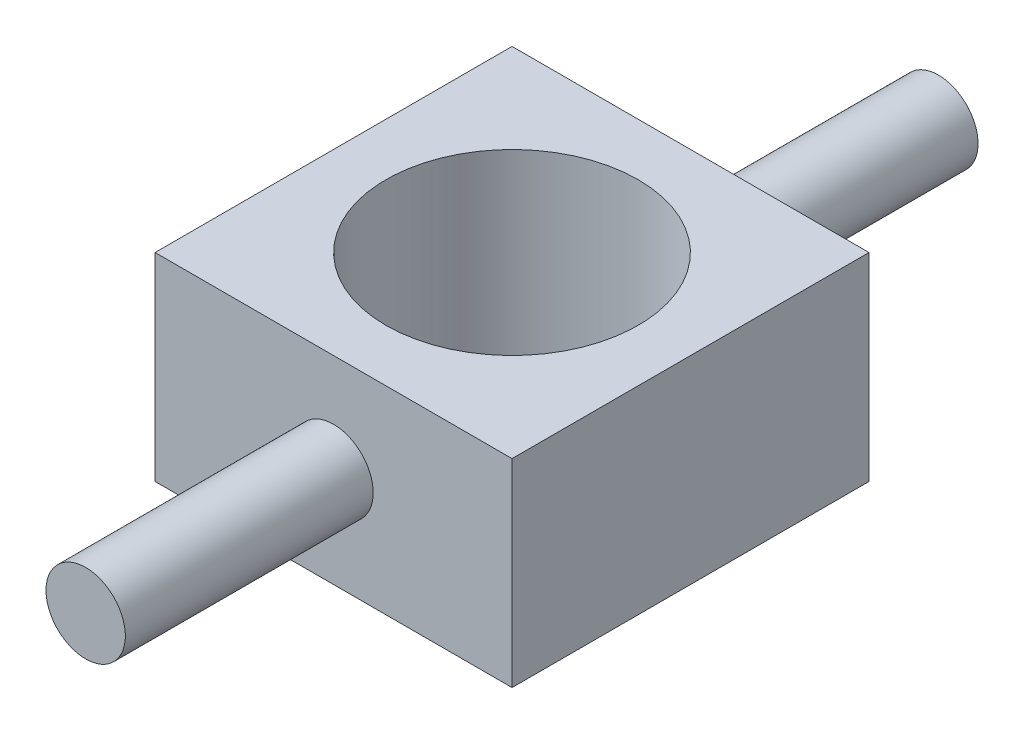
from build123d import *

# Parameters (mm, degrees)
BOSS_EXTRUDE1_DEPTH      = 10
BOSS_EXTRUDE1_DEPTH_BACK = 10
SKETCH1_W                = 36
SKETCH1_H                = 36
SKETCH2_R                = 12.725
CUT_EXTRUDE1_DEPTH       = 33.372828112
SKETCH5_R                = 4
BOSS_EXTRUDE2_DEPTH      = 25


with BuildPart() as part:
    # Sketch1 → Boss-Extrude1 (new, two sides: drawn at the far end of the back side and taken through both)
    with BuildSketch(Plane(origin=(0, 0, 0), x_dir=(1, 0, 0), z_dir=(0, 1, 0)).offset(-BOSS_EXTRUDE1_DEPTH_BACK)):
        Rectangle(SKETCH1_W, SKETCH1_H)
    extrude(amount=BOSS_EXTRUDE1_DEPTH + BOSS_EXTRUDE1_DEPTH_BACK)

    # Sketch2 → Cut-Extrude1 (cut, through all)
    with BuildSketch(Plane.XZ.offset(10)):
        Circle(SKETCH2_R)
    extrude(amount=-CUT_EXTRUDE1_DEPTH, mode=Mode.SUBTRACT)

    # Sketch5 → Boss-Extrude2 (add)
    with BuildSketch(Plane(origin=(0, 0, -18), x_dir=(-1, 0, 0), z_dir=(0, 0, -1))):
        Circle(SKETCH5_R)
    boss_extrude2 = extrude(amount=BOSS_EXTRUDE2_DEPTH)

    # Mirror1: Boss-Extrude2 across plane
    add(boss_extrude2.mirror(Plane.XY))


solid = part.part
